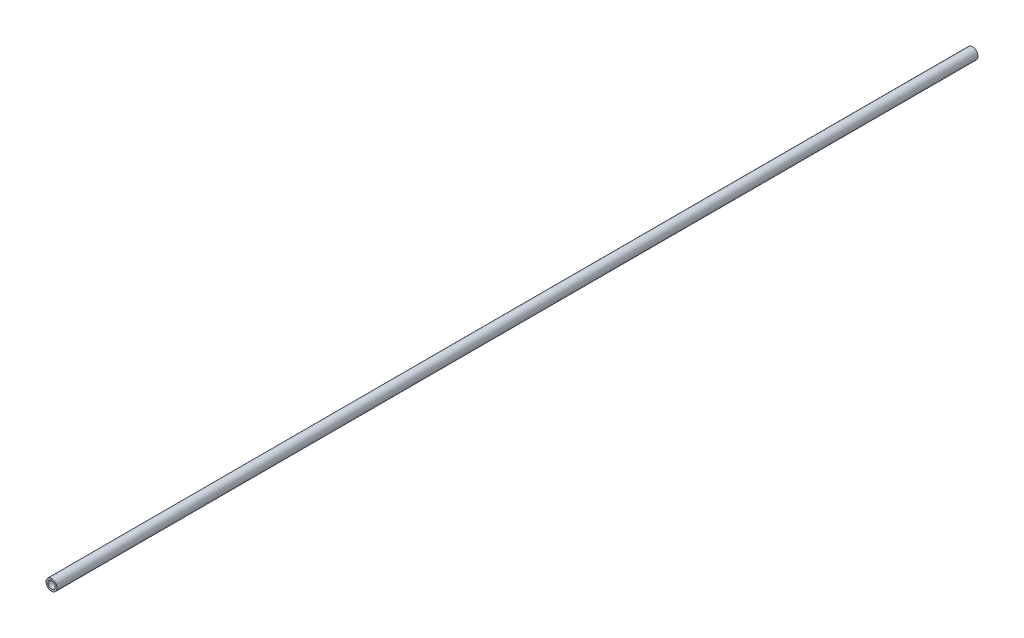
from build123d import *

# Parameters (mm, degrees)
ESQUISSE1_R        = 3
ESQUISSE1_R_2      = 2
BOSS_EXTRU_1_DEPTH = 500


with BuildPart() as part:
    # Esquisse1 → Boss.-Extru.1 (new body)
    with BuildSketch(Plane.XY):
        Circle(ESQUISSE1_R)
        Circle(ESQUISSE1_R_2, mode=Mode.SUBTRACT)
    extrude(amount=BOSS_EXTRU_1_DEPTH)


solid = part.part
